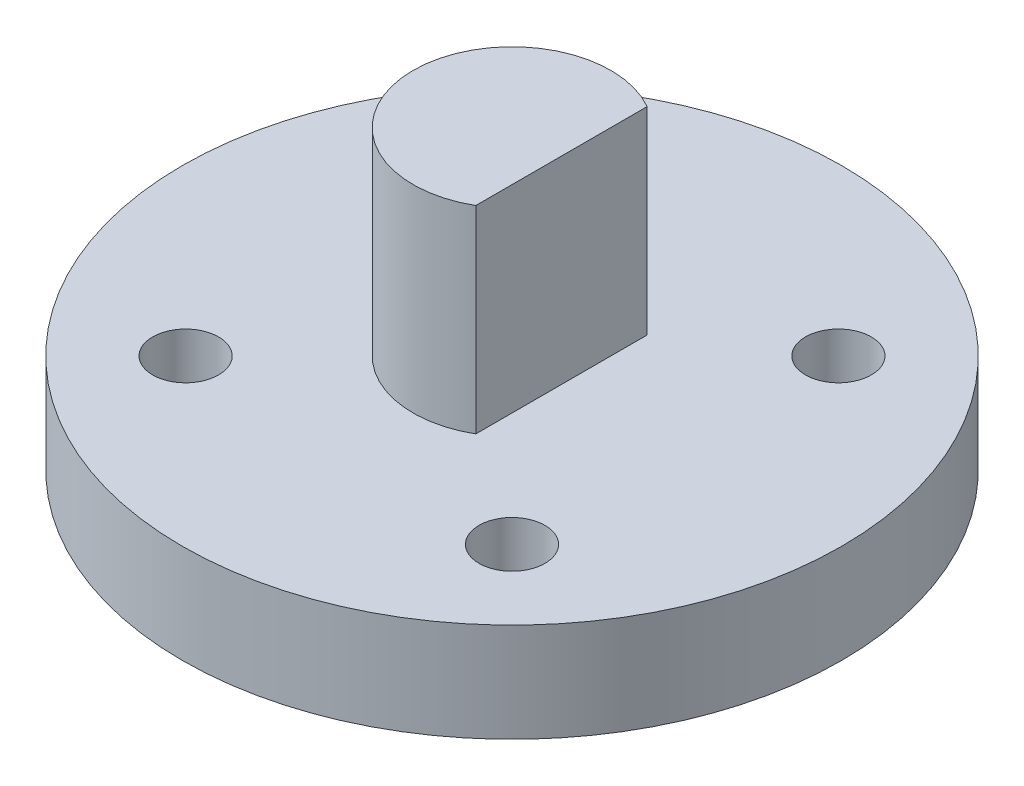
from build123d import *

# Parameters (mm, degrees)
CROQUIS1_R              = 10
CROQUIS1_R_2            = 1
SALIENTE_EXTRUIR1_DEPTH = 3
SALIENTE_EXTRUIR2_START = 3
CROQUIS1_3_R            = 3
SALIENTE_EXTRUIR2_DEPTH = 6
CORTAR_EXTRUIR1_START   = -6
CORTAR_EXTRUIR1_DEPTH   = 6


with BuildPart() as part:
    # Croquis1 → Saliente-Extruir1 (new body)
    with BuildSketch(Plane(origin=(0, 0, 0), x_dir=(1, 0, 0), z_dir=(0, 1, 0))):
        with Locations(Location((0, 0, 0), (0, 0, 270))):
            Circle(CROQUIS1_R)
        with Locations(Location((-4.949747468, 4.949747468, 0), (0, 0, 270))):
            Circle(CROQUIS1_R_2, mode=Mode.SUBTRACT)
        with Locations(Location((4.949747468, 4.949747468, 0), (0, 0, 270))):
            Circle(CROQUIS1_R_2, mode=Mode.SUBTRACT)
        with Locations(Location((4.949747468, -4.949747468, 0), (0, 0, 270))):
            Circle(CROQUIS1_R_2, mode=Mode.SUBTRACT)
        with Locations(Location((-4.949747468, -4.949747468, 0), (0, 0, 270))):
            Circle(CROQUIS1_R_2, mode=Mode.SUBTRACT)
    extrude(amount=SALIENTE_EXTRUIR1_DEPTH)

    # Croquis1<3> → Saliente-Extruir2 (add)
    with BuildSketch(Plane(origin=(0, 0, 0), x_dir=(1, 0, 0), z_dir=(0, 1, 0)).offset(SALIENTE_EXTRUIR2_START)):
        with Locations(Location((0, 0, 0), (0, 0, 270))):
            Circle(CROQUIS1_3_R)
    extrude(amount=SALIENTE_EXTRUIR2_DEPTH)

    # Croquis2 → Cortar-Extruir1 (cut)
    with BuildSketch(Plane(origin=(0, 9, 0), x_dir=(1, 0, 0), z_dir=(0, 1, 0)).offset(CORTAR_EXTRUIR1_START)):
        with BuildLine():
            Line((1.5, 2.598076211), (1.5, -2.598076211))
            ThreePointArc((1.5, -2.598076211), (3, 0), (1.5, 2.598076211))
        make_face()
    extrude(amount=CORTAR_EXTRUIR1_DEPTH, mode=Mode.SUBTRACT)


solid = part.part
